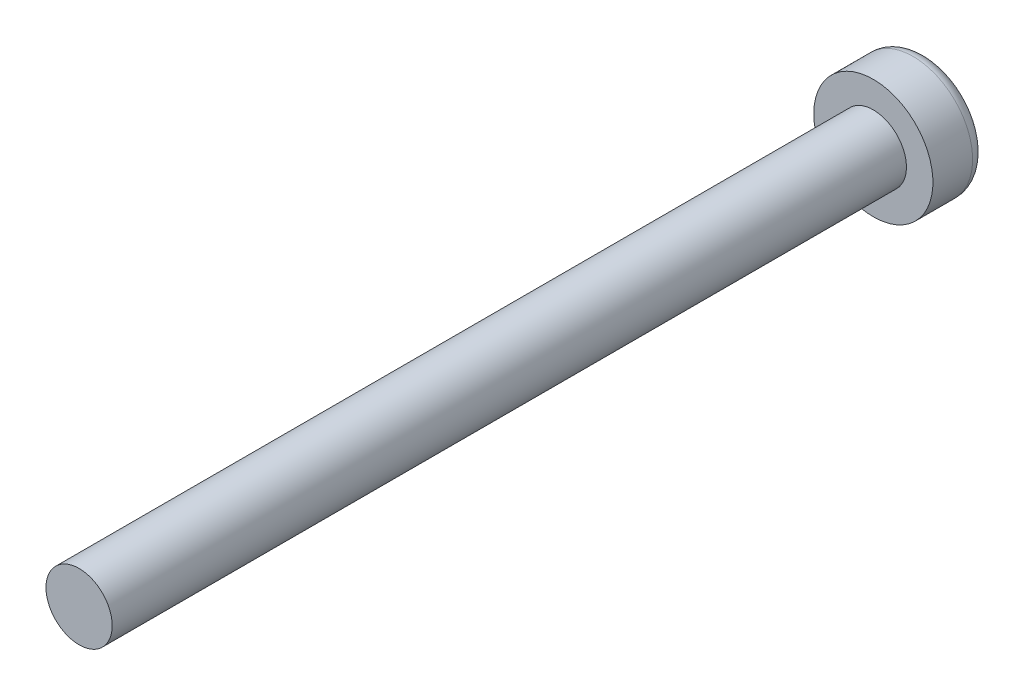
from build123d import *

# Parameters (mm, degrees)
SKETCH2_R           = 2.5
BOSS_EXTRUDE1_DEPTH = 60
SKETCH3_R           = 4.5
BOSS_EXTRUDE2_DEPTH = 4
FILLET2_R           = 1


with BuildPart() as part:
    # Sketch2 → Boss-Extrude1 (new body)
    with BuildSketch(Plane.XY):
        Circle(SKETCH2_R)
    extrude(amount=BOSS_EXTRUDE1_DEPTH)

    # Sketch3 → Boss-Extrude2 (add)
    with BuildSketch(Plane(origin=(0, 0, 0), x_dir=(-1, 0, 0), z_dir=(0, 0, -1))):
        Circle(SKETCH3_R)
    extrude(amount=BOSS_EXTRUDE2_DEPTH)

    # Fillet2
    fillet2_edges = [part.edges().sort_by_distance(p)[0] for p in [
        (4.5, 0, -4),
    ]]
    fillet(fillet2_edges, radius=FILLET2_R)


solid = part.part
